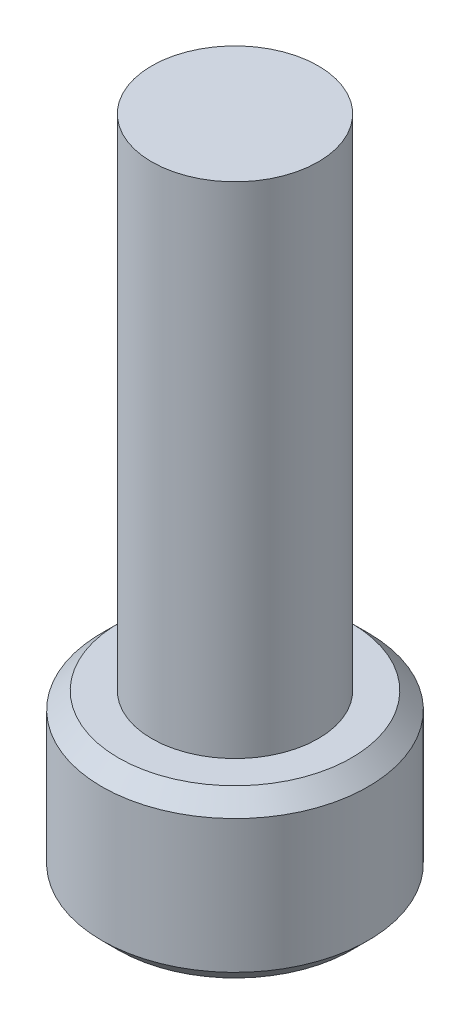
from build123d import *

# Parameters (mm, degrees)
SKETCH1_R           = 2.5
BOSS_EXTRUDE1_DEPTH = 15
SKETCH3_W           = 4
SKETCH3_H           = 5
CUT_EXTRUDE1_START  = -1
CUT_EXTRUDE1_DEPTH  = 30
CHAMFER1_SIZE       = 0.5


with BuildPart() as part:
    # Sketch1 → Boss-Extrude1 (new body)
    with BuildSketch(Plane(origin=(0, 0, 0), x_dir=(1, 0, 0), z_dir=(0, 1, 0))):
        with Locations(Location((0, 0, 0), (0, 0, 270))):
            Circle(SKETCH1_R)
    extrude(amount=BOSS_EXTRUDE1_DEPTH)

    # Sketch3 → Revolve1 (revolve)
    with BuildSketch(Plane.XY, mode=Mode.PRIVATE) as revolve1_sk:
        with Locations((-2, -2.5)):
            Rectangle(SKETCH3_W, SKETCH3_H)
    revolve(revolve1_sk.sketch.rotate(Axis((0, -5, 0), (0, 1, 0)), 270), axis=Axis((0, -5, 0), (0, 1, 0)))

    # Sketch4 → Cut-Extrude1 (cut)
    with BuildSketch(Plane(origin=(0, 0, 0), x_dir=(1, 0, 0), z_dir=(0, 1, 0)).offset(CUT_EXTRUDE1_START)):
        Polygon((2.886751346, 0), (1.443375673, 2.5), (-1.443375673, 2.5), (-2.886751346, 0), (-1.443375673, -2.5), (1.443375673, -2.5), align=None)
    extrude(amount=-CUT_EXTRUDE1_DEPTH, mode=Mode.SUBTRACT)

    # Chamfer1
    chamfer1_edges = [part.edges().sort_by_distance(p)[0] for p in [
        (0, 0, 4),
        (0, -5, 4),
    ]]
    chamfer(chamfer1_edges, length=CHAMFER1_SIZE)


solid = part.part
